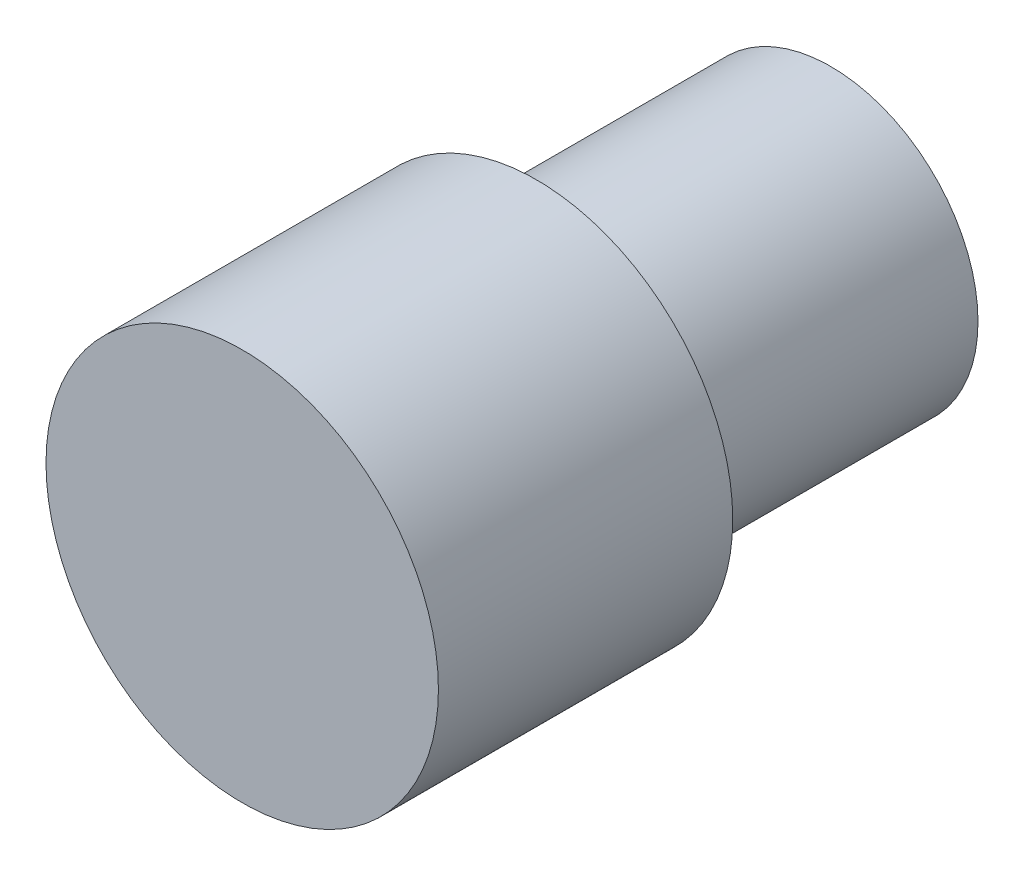
from build123d import *

# Parameters (mm, degrees)
SKETCH1_R           = 7.5
BOSS_EXTRUDE1_DEPTH = 15
SKETCH3_R           = 10
BOSS_EXTRUDE2_DEPTH = 15


with BuildPart() as part:
    # Sketch1 → Boss-Extrude1 (new body)
    with BuildSketch(Plane.XY):
        Circle(SKETCH1_R)
    extrude(amount=BOSS_EXTRUDE1_DEPTH)

    # Sketch3 → Boss-Extrude2 (add)
    with BuildSketch(Plane.XY.offset(15)):
        Circle(SKETCH3_R)
    extrude(amount=BOSS_EXTRUDE2_DEPTH)


solid = part.part
